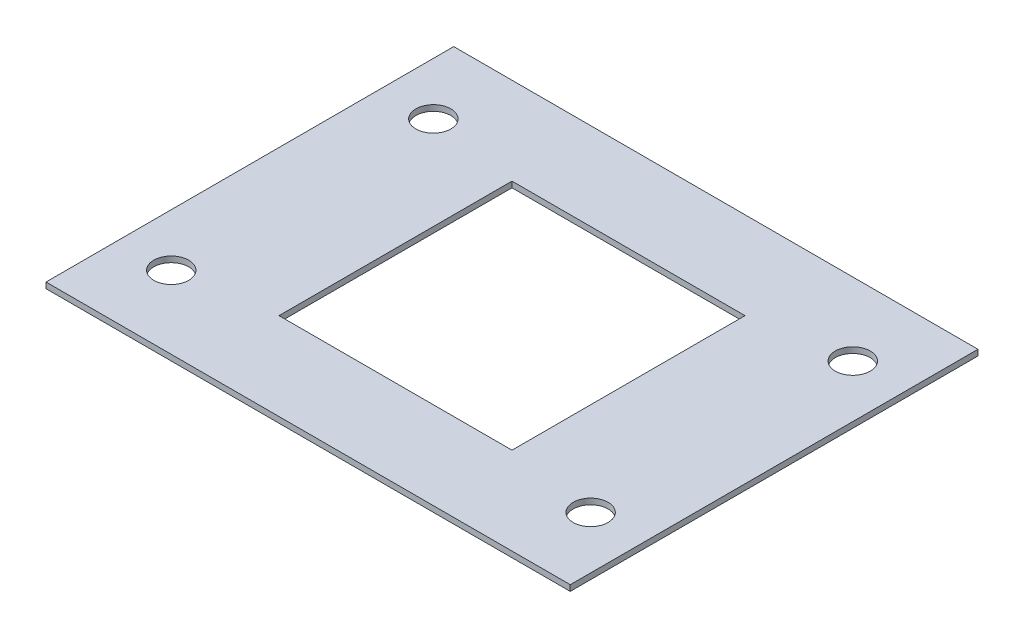
from build123d import *

# Parameters (mm, degrees)
CROQUIS1_R              = 1.5
CROQUIS1_W              = 20
CROQUIS1_H              = 20
SALIENTE_EXTRUIR1_DEPTH = 0.5
CROQUIS2_W              = 45
CROQUIS2_H              = 5
CORTAR_EXTRUIR1_DEPTH   = 10


with BuildPart() as part:
    # Croquis1 → Saliente-Extruir1 (new body)
    with BuildSketch(Plane(origin=(0, 0, 0), x_dir=(1, 0, 0), z_dir=(0, 1, 0))):
        with BuildLine():
            ThreePointArc((-12.5, -12.398453182), (-12.449747468, -12.449747468), (-12.398453182, -12.5))
            Line((-12.398453182, -12.5), (32.5, -12.5))
            Line((32.5, -12.5), (32.5, 32.5))
            Line((32.5, 32.5), (-12.5, 32.5))
            Line((-12.5, 32.5), (-12.5, -12.398453182))
        make_face()
        with Locations(Location((-8, -1.25, 0), (0, 0, 270))):
            Circle(CROQUIS1_R, mode=Mode.SUBTRACT)
        with Locations(Location((28, -1.25, 0), (0, 0, 270))):
            Circle(CROQUIS1_R, mode=Mode.SUBTRACT)
        with Locations(Location((-8, 21.25, 0), (0, 0, 270))):
            Circle(CROQUIS1_R, mode=Mode.SUBTRACT)
        with Locations((10, 10)):
            Rectangle(CROQUIS1_W, CROQUIS1_H, mode=Mode.SUBTRACT)
        with Locations(Location((28, 21.25, 0), (0, 0, 270))):
            Circle(CROQUIS1_R, mode=Mode.SUBTRACT)
    extrude(amount=SALIENTE_EXTRUIR1_DEPTH)

    # Croquis2 → Cortar-Extruir1 (cut)
    with BuildSketch(Plane(origin=(0, 0.5, 0), x_dir=(1, 0, 0), z_dir=(0, 1, 0))):
        with Locations((10, 30)):
            Rectangle(CROQUIS2_W, CROQUIS2_H)
        with Locations((10, -10)):
            Rectangle(CROQUIS2_W, CROQUIS2_H)
    extrude(amount=-CORTAR_EXTRUIR1_DEPTH, mode=Mode.SUBTRACT)


solid = part.part
